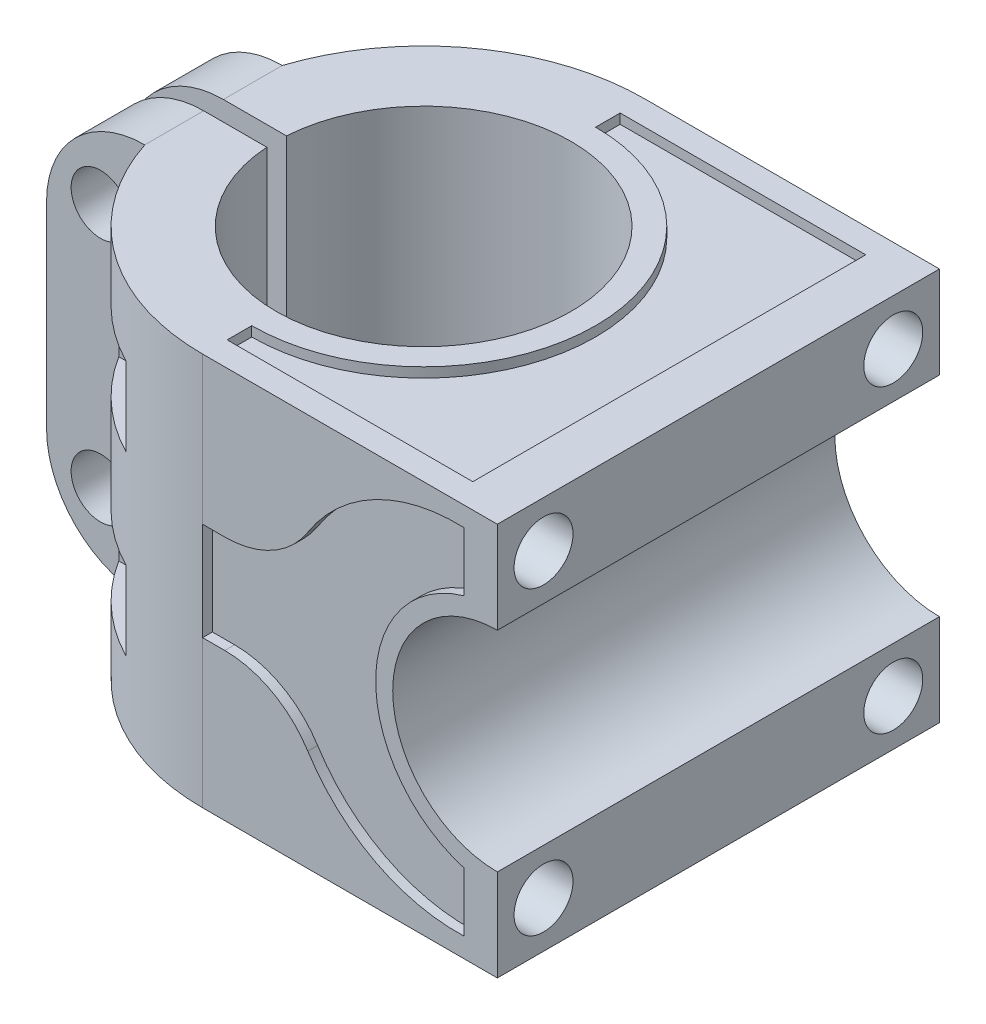
from build123d import *

# Parameters (mm, degrees)
BOSS_EXTRUDE1_DEPTH     = 40
FILLET1_R               = 10
SKETCH2_R               = 3
CUT_EXTRUDE1_DEPTH      = 30
CUT_EXTRUDE2_DEPTH      = 56.598274214
CUT_EXTRUDE2_DEPTH_BACK = 56.598274214
SKETCH4_R               = 10.65
SKETCH3_R               = 3
CUT_EXTRUDE3_DEPTH      = 15
SKETCH10_W              = 8
SKETCH10_H              = 8
CUT_EXTRUDE4_DEPTH      = 22
CUT_EXTRUDE5_DEPTH      = 1
CUT_EXTRUDE6_DEPTH      = 1


with BuildPart() as part:
    # Sketch1 → Boss-Extrude1 (new body)
    with BuildSketch(Plane(origin=(0, 0, 0), x_dir=(1, 0, 0), z_dir=(0, 1, 0))):
        with BuildLine():
            Line((0, 22.5), (30, 22.5))
            Line((30, 22.5), (30, -22.5))
            Line((30, -22.5), (0, -22.5))
            ThreePointArc((0, -22.5), (-13.205112646, -18.217436702), (-21.38340478, -7))
            Line((-21.38340478, -7), (-31.38340478, -7))
            Line((-31.38340478, -7), (-31.38340478, -1))
            Line((-31.38340478, -1), (-14.966629547, -1))
            ThreePointArc((-14.966629547, -1), (15, 0), (-14.966629547, 1))
            Line((-14.966629547, 1), (-31.38340478, 1))
            Line((-31.38340478, 1), (-31.38340478, 7))
            Line((-31.38340478, 7), (-21.38340478, 7))
            ThreePointArc((-21.38340478, 7), (-13.205112646, 18.217436702), (0, 22.5))
        make_face()
    extrude(amount=BOSS_EXTRUDE1_DEPTH)

    # Fillet1
    fillet1_edges = [part.edges().sort_by_distance(p)[0] for p in [
        (-31.38340478, 40, -4),
        (-31.38340478, 0, -4),
        (-31.38340478, 0, 4),
        (-31.38340478, 40, 4),
    ]]
    fillet(fillet1_edges, radius=FILLET1_R)

    # Sketch2 → Cut-Extrude1 (cut)
    with BuildSketch(Plane.XY.offset(7)):
        with Locations((-25.88340478, 32.5)):
            Circle(SKETCH2_R)
        with Locations((-25.88340478, 7.5)):
            Circle(SKETCH2_R)
    extrude(amount=-CUT_EXTRUDE1_DEPTH, mode=Mode.SUBTRACT)

    # Sketch4 → Cut-Extrude2 (cut, two sides: drawn at the far end of the back side and taken through both)
    with BuildSketch(Plane.XY.offset(-CUT_EXTRUDE2_DEPTH_BACK)):
        with Locations((30, 20)):
            Circle(SKETCH4_R)
    extrude(amount=CUT_EXTRUDE2_DEPTH + CUT_EXTRUDE2_DEPTH_BACK, mode=Mode.SUBTRACT)

    # Sketch3 → Cut-Extrude3 (cut)
    with BuildSketch(Plane(origin=(30, 0, 0), x_dir=(0, 0, -1), z_dir=(1, 0, 0))):
        with Locations((-17.8, 35.3)):
            Circle(SKETCH3_R)
        with Locations((17.8, 35.3)):
            Circle(SKETCH3_R)
        with Locations((17.8, 4.7)):
            Circle(SKETCH3_R)
        with Locations((-17.8, 4.7)):
            Circle(SKETCH3_R)
    extrude(amount=-CUT_EXTRUDE3_DEPTH, mode=Mode.SUBTRACT)

    # Sketch10 → Cut-Extrude4 (cut)
    with BuildSketch(Plane.ZY.offset(31.38340478)):
        with Locations((-16, 29)):
            Rectangle(SKETCH10_W, SKETCH10_H)
        with Locations((16, 29)):
            Rectangle(SKETCH10_W, SKETCH10_H)
        with Locations((16, 11)):
            Rectangle(SKETCH10_W, SKETCH10_H)
        with Locations((-16, 11)):
            Rectangle(SKETCH10_W, SKETCH10_H)
    extrude(amount=-CUT_EXTRUDE4_DEPTH, mode=Mode.SUBTRACT)

    # Sketch11 → Cut-Extrude5 (cut)
    with BuildSketch(Plane(origin=(0, 40, 0), x_dir=(1, 0, 0), z_dir=(0, 1, 0))):
        with BuildLine():
            Line((25, 20), (25, -20))
            Line((25, -20), (0, -20))
            Line((0, -20), (0, -17.5))
            ThreePointArc((0, -17.5), (17.5, 0), (0, 17.5))
            Line((0, 17.5), (0, 20))
            Line((0, 20), (25, 20))
        make_face()
    cut_extrude5 = extrude(amount=-CUT_EXTRUDE5_DEPTH, mode=Mode.SUBTRACT)

    # Sketch14 → Cut-Extrude6 (cut)
    with BuildSketch(Plane.XY.offset(22.5)):
        with BuildLine():
            Line((7.05e-07, 24.999999636), (2.260270537, 24.999999636))
            ThreePointArc((2.260270537, 24.999999636), (7.080945531, 26.238658837), (10.707385838, 29.647781115))
            ThreePointArc((10.707385838, 29.647781115), (17.545274901, 35.950998172), (26.616595925, 37.999999636))
            Line((26.616595925, 37.999999636), (26.616595925, 31.999999636))
            ThreePointArc((26.616595925, 31.999999636), (17.616595925, 19.999999636), (26.616595925, 7.999999636))
            Line((26.616595925, 7.999999636), (26.616595925, 1.999999636))
            ThreePointArc((26.616595925, 1.999999636), (17.545274901, 4.0490011), (10.707385838, 10.352218158))
            ThreePointArc((10.707385838, 10.352218158), (7.080945531, 13.761340436), (2.260270537, 14.999999636))
            Line((2.260270537, 14.999999636), (7.05e-07, 14.999999636))
            Line((7.05e-07, 14.999999636), (7.05e-07, 24.999999636))
        make_face()
    cut_extrude6 = extrude(amount=-CUT_EXTRUDE6_DEPTH, mode=Mode.SUBTRACT)

    # Mirror3: Cut-Extrude6 across plane
    add(cut_extrude6.mirror(Plane.XY), mode=Mode.SUBTRACT)

    # Mirror4: Cut-Extrude5 across plane
    add(cut_extrude5.mirror(Plane.ZX.offset(20)), mode=Mode.SUBTRACT)


solid = part.part
